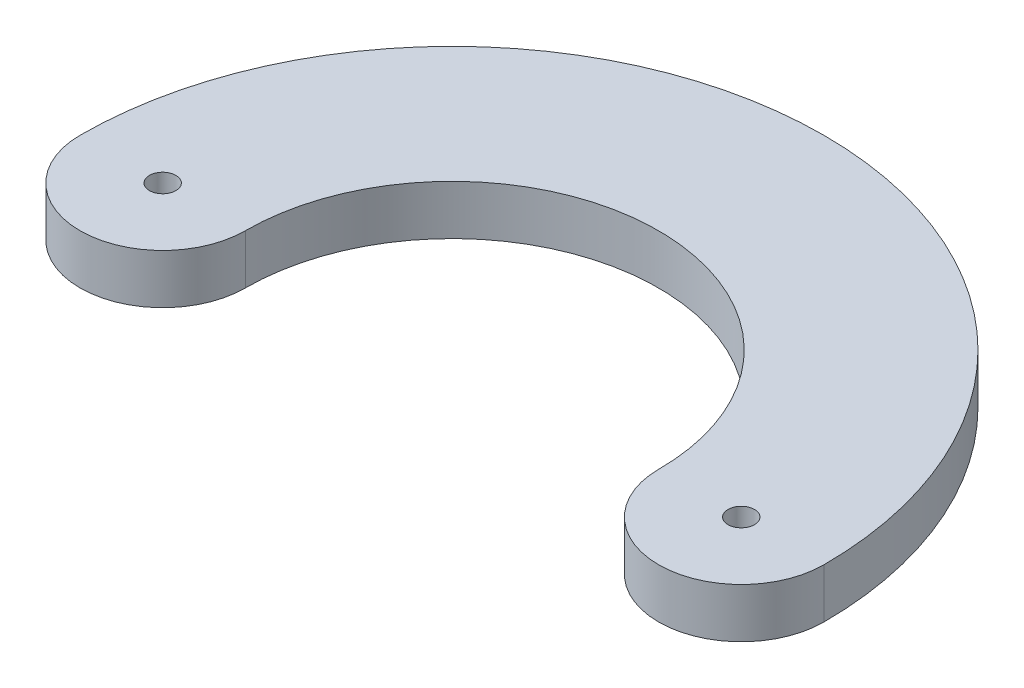
from build123d import *

# Parameters (mm, degrees)
SKETCH1_R           = 1.6
BOSS_EXTRUDE1_DEPTH = 6


with BuildPart() as part:
    # Sketch1 → Boss-Extrude1 (new body)
    with BuildSketch(Plane(origin=(0, 0, 0), x_dir=(1, 0, 0), z_dir=(0, 1, 0))):
        with BuildLine():
            ThreePointArc((25, 0), (0, 25), (-25, 0))
            ThreePointArc((-25, 0), (-35, -10), (-45, 0))
            ThreePointArc((-45, 0), (0, 45), (45, 0))
            ThreePointArc((45, 0), (35, -10), (25, 0))
        make_face()
        with Locations(Location((-35, 0, 0), (0, 0, 270))):
            Circle(SKETCH1_R, mode=Mode.SUBTRACT)
        with Locations(Location((35, 0, 0), (0, 0, 270))):
            Circle(SKETCH1_R, mode=Mode.SUBTRACT)
    extrude(amount=BOSS_EXTRUDE1_DEPTH)


solid = part.part
